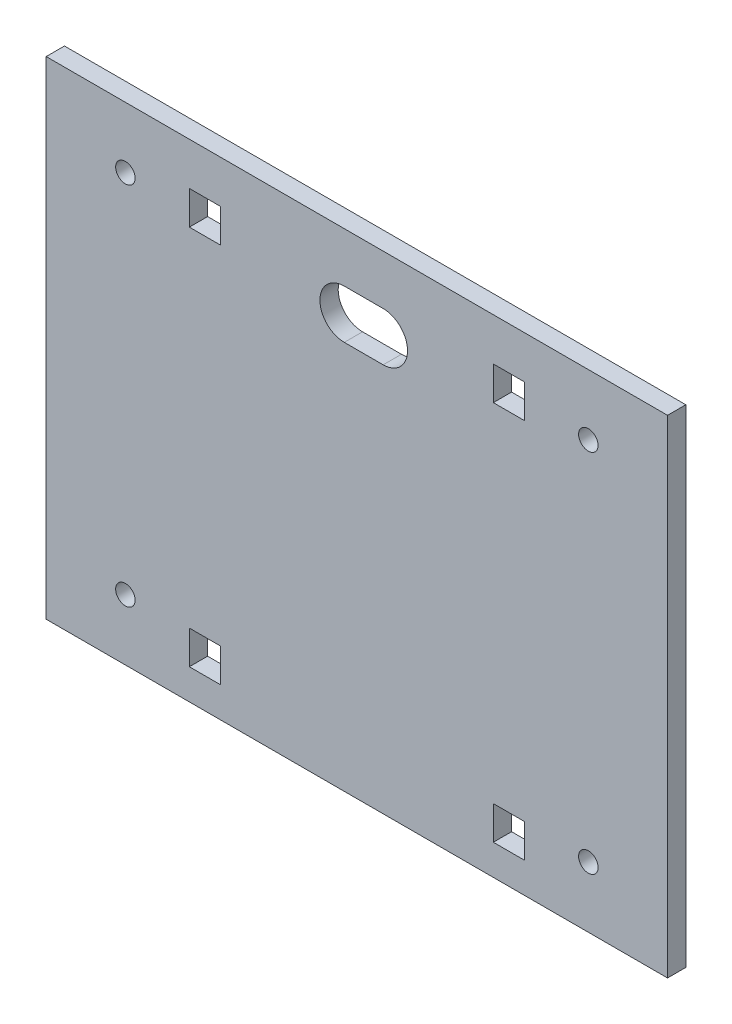
from build123d import *

# Parameters (mm, degrees)
SKETCH_1_W                       = 102
SKETCH_1_H                       = 80
SKETCH_1_R                       = 1.6
EXTRUDE_1_DEPTH                  = 3
CUT_EXTRUDE_1_DEPTH              = 3
SKETCH_4_W                       = 5.1
SKETCH_4_H                       = 5.5
CUT_EXTRUDE_2_DEPTH              = 5
PATTERN_LINEAR_1_COUNT           = 2
PATTERN_LINEAR_1_PITCH           = 62.5
PATTERN_LINEAR_1_COPY_1_SKETCH_W = 5.1
PATTERN_LINEAR_1_COPY_1_SKETCH_H = 5.5
PATTERN_LINEAR_1_COPY_1_DEPTH    = 5


with BuildPart() as part:
    # 草图1 → 凸台-拉伸1 (new body)
    with BuildSketch(Plane.XY):
        with Locations((0, -65.25)):
            Rectangle(SKETCH_1_W, SKETCH_1_H)
        with Locations((-38, -35.25)):
            Circle(SKETCH_1_R, mode=Mode.SUBTRACT)
        with Locations((-38, -95.25)):
            Circle(SKETCH_1_R, mode=Mode.SUBTRACT)
        with Locations((38, -95.25)):
            Circle(SKETCH_1_R, mode=Mode.SUBTRACT)
        with Locations((38, -35.25)):
            Circle(SKETCH_1_R, mode=Mode.SUBTRACT)
    extrude(amount=EXTRUDE_1_DEPTH)

    # 草图3 → 切除-拉伸1 (cut)
    with BuildSketch(Plane.XY.offset(3)):
        with BuildLine():
            Line((-2.065542075, -33.415194888), (4.318378476, -33.415194888))
            ThreePointArc((4.318378476, -33.415194888), (8.318378476, -37.415194888), (4.318378476, -41.415194888))
            Line((4.318378476, -41.415194888), (-2.065542075, -41.415194888))
            ThreePointArc((-2.065542075, -41.415194888), (-6.065542075, -37.415194888), (-2.065542075, -33.415194888))
        make_face()
    extrude(amount=-CUT_EXTRUDE_1_DEPTH, mode=Mode.SUBTRACT)

    # 草图4 → 切除-拉伸2 (cut)
    with BuildSketch(Plane.XY.offset(3)):
        with Locations((-24.95, -97.5)):
            Rectangle(SKETCH_4_W, SKETCH_4_H)
    cut_extrude_2 = extrude(amount=-CUT_EXTRUDE_2_DEPTH, mode=Mode.SUBTRACT)

    # 镜向1: 切除-拉伸2 across plane
    add(cut_extrude_2.mirror(Plane.ZY), mode=Mode.SUBTRACT)

    # 阵列(线性)1: 切除-拉伸2 ×2
    with Locations(*[(0, i * PATTERN_LINEAR_1_PITCH, 0) for i in range(1, PATTERN_LINEAR_1_COUNT)]):
        add(cut_extrude_2, mode=Mode.SUBTRACT)

    # 阵列(线性)1 copy 1 sketch → 阵列(线性)1 copy 1 (cut)
    with BuildSketch(Plane(origin=(0, 62.5, 3), x_dir=(-1, 0, 0), z_dir=(0, 0, 1))):
        with Locations((-24.95, 97.5)):
            Rectangle(PATTERN_LINEAR_1_COPY_1_SKETCH_W, PATTERN_LINEAR_1_COPY_1_SKETCH_H)
    extrude(amount=-PATTERN_LINEAR_1_COPY_1_DEPTH, mode=Mode.SUBTRACT)


solid = part.part
